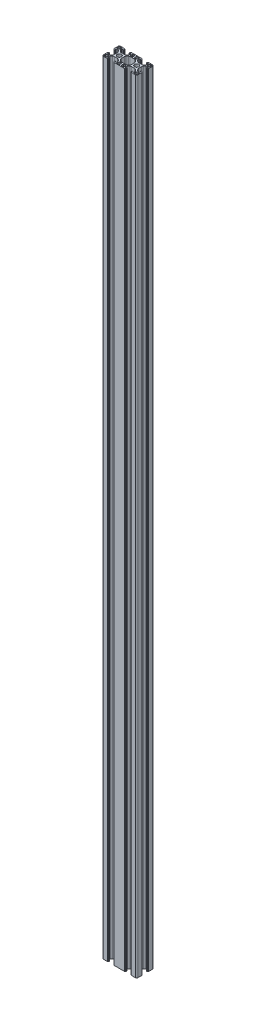
from build123d import *

# Parameters (mm, degrees)
EXTRUDE_1_DEPTH = 905


with BuildPart() as part:
    # Эскиз2 → Бобышка-Вытянуть1 (new body)
    with BuildSketch(Plane(origin=(0, 0, 0), x_dir=(1, 0, 0), z_dir=(0, 1, 0))):
        with BuildLine():
            Line((10.155065778, 4.294911016), (12.053846447, 4.294911016))
            ThreePointArc((12.053846447, 4.294911016), (12.819213312, 4.447151951), (13.468060009, 4.880697454))
            Line((13.468060009, 4.880697454), (14.76927934, 6.181916784))
            ThreePointArc((14.76927934, 6.181916784), (15.202824843, 6.830763482), (15.355065778, 7.596130347))
            Line((15.355065778, 7.596130347), (15.355065778, 8.494911016))
            ThreePointArc((15.355065778, 8.494911016), (15.208619168, 8.848464407), (14.855065778, 8.994911016))
            Line((14.855065778, 8.994911016), (14.752172559, 8.994911016))
            ThreePointArc((14.752172559, 8.994911016), (14.560830843, 8.956850782), (14.398619168, 8.848464407))
            Line((14.398619168, 8.848464407), (13.918289082, 8.368134321))
            ThreePointArc((13.918289082, 8.368134321), (13.837183245, 8.313941133), (13.741512387, 8.294911016))
            Line((13.741512387, 8.294911016), (13.455065778, 8.294911016))
            ThreePointArc((13.455065778, 8.294911016), (13.278289082, 8.368134321), (13.205065778, 8.544911016))
            Line((13.205065778, 8.544911016), (13.205065778, 9.693981836))
            ThreePointArc((13.205065778, 9.693981836), (13.248999761, 9.800047854), (13.355065778, 9.843981836))
            Line((13.355065778, 9.843981836), (13.855065778, 9.843981836))
            Line((13.855065778, 9.843981836), (13.855065778, 10.144911016))
            ThreePointArc((13.855065778, 10.144911016), (13.898999761, 10.250977033), (14.005065778, 10.294911016))
            Line((14.005065778, 10.294911016), (18.655065778, 10.294911016))
            ThreePointArc((18.655065778, 10.294911016), (19.715725949, 9.855571188), (20.155065778, 8.794911016))
            Line((20.155065778, 8.794911016), (20.155065778, 4.144911016))
            ThreePointArc((20.155065778, 4.144911016), (20.111131795, 4.038844999), (20.005065778, 3.994911016))
            Line((20.005065778, 3.994911016), (19.704136598, 3.994911016))
            Line((19.704136598, 3.994911016), (19.704136598, 3.494911016))
            ThreePointArc((19.704136598, 3.494911016), (19.660202615, 3.388844999), (19.554136598, 3.344911016))
            Line((19.554136598, 3.344911016), (18.405065778, 3.344911016))
            ThreePointArc((18.405065778, 3.344911016), (18.228289082, 3.418134321), (18.155065778, 3.594911016))
            Line((18.155065778, 3.594911016), (18.155065778, 3.881357625))
            ThreePointArc((18.155065778, 3.881357625), (18.174095895, 3.977028483), (18.228289082, 4.058134321))
            Line((18.228289082, 4.058134321), (18.708619168, 4.538464407))
            ThreePointArc((18.708619168, 4.538464407), (18.817005544, 4.700676081), (18.855065778, 4.892017797))
            Line((18.855065778, 4.892017797), (18.855065778, 4.994911016))
            ThreePointArc((18.855065778, 4.994911016), (18.708619168, 5.348464407), (18.355065778, 5.494911016))
            Line((18.355065778, 5.494911016), (17.456285109, 5.494911016))
            ThreePointArc((17.456285109, 5.494911016), (16.690918244, 5.342670081), (16.042071546, 4.909124578))
            Line((16.042071546, 4.909124578), (14.740852215, 3.607905247))
            ThreePointArc((14.740852215, 3.607905247), (14.307306713, 2.95905855), (14.155065778, 2.193691685))
            Line((14.155065778, 2.193691685), (14.155065778, 0.294911016))
            Line((14.155065778, 0.294911016), (14.155065778, -1.603869653))
            ThreePointArc((14.155065778, -1.603869653), (14.307306713, -2.369236518), (14.740852215, -3.018083216))
            Line((14.740852215, -3.018083216), (16.042071546, -4.319302546))
            ThreePointArc((16.042071546, -4.319302546), (16.690918244, -4.752848049), (17.456285109, -4.905088984))
            Line((17.456285109, -4.905088984), (18.355065778, -4.905088984))
            ThreePointArc((18.355065778, -4.905088984), (18.708619168, -4.758642375), (18.855065778, -4.405088984))
            Line((18.855065778, -4.405088984), (18.855065778, -4.302195765))
            ThreePointArc((18.855065778, -4.302195765), (18.817005544, -4.110854049), (18.708619168, -3.948642375))
            Line((18.708619168, -3.948642375), (18.228289082, -3.468312289))
            ThreePointArc((18.228289082, -3.468312289), (18.174095895, -3.387206452), (18.155065778, -3.291535593))
            Line((18.155065778, -3.291535593), (18.155065778, -3.005088984))
            ThreePointArc((18.155065778, -3.005088984), (18.228289082, -2.828312289), (18.405065778, -2.755088984))
            Line((18.405065778, -2.755088984), (19.554136598, -2.755088984))
            ThreePointArc((19.554136598, -2.755088984), (19.660202615, -2.799022967), (19.704136598, -2.905088984))
            Line((19.704136598, -2.905088984), (19.704136598, -3.405088984))
            Line((19.704136598, -3.405088984), (20.005065778, -3.405088984))
            ThreePointArc((20.005065778, -3.405088984), (20.111131795, -3.449022967), (20.155065778, -3.555088984))
            Line((20.155065778, -3.555088984), (20.155065778, -8.205088984))
            ThreePointArc((20.155065778, -8.205088984), (19.715725949, -9.265749156), (18.655065778, -9.705088984))
            Line((18.655065778, -9.705088984), (14.005065778, -9.705088984))
            ThreePointArc((14.005065778, -9.705088984), (13.898999761, -9.661155001), (13.855065778, -9.555088984))
            Line((13.855065778, -9.555088984), (13.855065778, -9.254159805))
            Line((13.855065778, -9.254159805), (13.355065778, -9.254159805))
            ThreePointArc((13.355065778, -9.254159805), (13.248999761, -9.210225822), (13.205065778, -9.104159805))
            Line((13.205065778, -9.104159805), (13.205065778, -7.955088984))
            ThreePointArc((13.205065778, -7.955088984), (13.278289082, -7.778312289), (13.455065778, -7.705088984))
            Line((13.455065778, -7.705088984), (13.741512387, -7.705088984))
            ThreePointArc((13.741512387, -7.705088984), (13.837183245, -7.724119101), (13.918289082, -7.778312289))
            Line((13.918289082, -7.778312289), (14.398619168, -8.258642375))
            ThreePointArc((14.398619168, -8.258642375), (14.560830843, -8.36702875), (14.752172559, -8.405088984))
            Line((14.752172559, -8.405088984), (14.855065778, -8.405088984))
            ThreePointArc((14.855065778, -8.405088984), (15.208619168, -8.258642375), (15.355065778, -7.905088984))
            Line((15.355065778, -7.905088984), (15.355065778, -7.006308315))
            ThreePointArc((15.355065778, -7.006308315), (15.202824843, -6.24094145), (14.76927934, -5.592094753))
            Line((14.76927934, -5.592094753), (13.468060009, -4.290875422))
            ThreePointArc((13.468060009, -4.290875422), (12.819213312, -3.857329919), (12.053846447, -3.705088984))
            Line((12.053846447, -3.705088984), (10.155065778, -3.705088984))
            Line((10.155065778, -3.705088984), (8.256285109, -3.705088984))
            ThreePointArc((8.256285109, -3.705088984), (7.490918244, -3.857329919), (6.842071546, -4.290875422))
            Line((6.842071546, -4.290875422), (5.540852215, -5.592094753))
            ThreePointArc((5.540852215, -5.592094753), (5.107306713, -6.24094145), (4.955065778, -7.006308315))
            Line((4.955065778, -7.006308315), (4.955065778, -7.905088984))
            ThreePointArc((4.955065778, -7.905088984), (5.101512387, -8.258642375), (5.455065778, -8.405088984))
            Line((5.455065778, -8.405088984), (5.557958996, -8.405088984))
            ThreePointArc((5.557958996, -8.405088984), (5.749300713, -8.36702875), (5.911512387, -8.258642375))
            Line((5.911512387, -8.258642375), (6.391842473, -7.778312289))
            ThreePointArc((6.391842473, -7.778312289), (6.47294831, -7.724119101), (6.568619168, -7.705088984))
            Line((6.568619168, -7.705088984), (6.855065778, -7.705088984))
            ThreePointArc((6.855065778, -7.705088984), (7.031842473, -7.778312289), (7.105065778, -7.955088984))
            Line((7.105065778, -7.955088984), (7.105065778, -9.104159805))
            ThreePointArc((7.105065778, -9.104159805), (7.061131795, -9.210225822), (6.955065778, -9.254159805))
            Line((6.955065778, -9.254159805), (6.455065778, -9.254159805))
            Line((6.455065778, -9.254159805), (6.455065778, -9.555088984))
            ThreePointArc((6.455065778, -9.555088984), (6.411131795, -9.661155001), (6.305065778, -9.705088984))
            Line((6.305065778, -9.705088984), (1.655065778, -9.705088984))
            Line((1.655065778, -9.705088984), (-1.344934222, -9.705088984))
            Line((-1.344934222, -9.705088984), (-5.994934222, -9.705088984))
            ThreePointArc((-5.994934222, -9.705088984), (-6.101000239, -9.661155001), (-6.144934222, -9.555088984))
            Line((-6.144934222, -9.555088984), (-6.144934222, -9.254159805))
            Line((-6.144934222, -9.254159805), (-6.644934222, -9.254159805))
            ThreePointArc((-6.644934222, -9.254159805), (-6.751000239, -9.210225822), (-6.794934222, -9.104159805))
            Line((-6.794934222, -9.104159805), (-6.794934222, -7.955088984))
            ThreePointArc((-6.794934222, -7.955088984), (-6.721710918, -7.778312289), (-6.544934222, -7.705088984))
            Line((-6.544934222, -7.705088984), (-6.258487613, -7.705088984))
            ThreePointArc((-6.258487613, -7.705088984), (-6.162816755, -7.724119101), (-6.081710918, -7.778312289))
            Line((-6.081710918, -7.778312289), (-5.601380832, -8.258642375))
            ThreePointArc((-5.601380832, -8.258642375), (-5.439169157, -8.36702875), (-5.247827441, -8.405088984))
            Line((-5.247827441, -8.405088984), (-5.144934222, -8.405088984))
            ThreePointArc((-5.144934222, -8.405088984), (-4.791380832, -8.258642375), (-4.644934222, -7.905088984))
            Line((-4.644934222, -7.905088984), (-4.644934222, -7.006308315))
            ThreePointArc((-4.644934222, -7.006308315), (-4.797175157, -6.24094145), (-5.23072066, -5.592094753))
            Line((-5.23072066, -5.592094753), (-6.531939991, -4.290875422))
            ThreePointArc((-6.531939991, -4.290875422), (-7.180786688, -3.857329919), (-7.946153553, -3.705088984))
            Line((-7.946153553, -3.705088984), (-9.844934222, -3.705088984))
            Line((-9.844934222, -3.705088984), (-11.743714891, -3.705088984))
            ThreePointArc((-11.743714891, -3.705088984), (-12.509081756, -3.857329919), (-13.157928454, -4.290875422))
            Line((-13.157928454, -4.290875422), (-14.459147785, -5.592094753))
            ThreePointArc((-14.459147785, -5.592094753), (-14.892693287, -6.24094145), (-15.044934222, -7.006308315))
            Line((-15.044934222, -7.006308315), (-15.044934222, -7.905088984))
            ThreePointArc((-15.044934222, -7.905088984), (-14.898487613, -8.258642375), (-14.544934222, -8.405088984))
            Line((-14.544934222, -8.405088984), (-14.442041004, -8.405088984))
            ThreePointArc((-14.442041004, -8.405088984), (-14.250699287, -8.36702875), (-14.088487613, -8.258642375))
            Line((-14.088487613, -8.258642375), (-13.608157527, -7.778312289))
            ThreePointArc((-13.608157527, -7.778312289), (-13.52705169, -7.724119101), (-13.431380832, -7.705088984))
            Line((-13.431380832, -7.705088984), (-13.144934222, -7.705088984))
            ThreePointArc((-13.144934222, -7.705088984), (-12.968157527, -7.778312289), (-12.894934222, -7.955088984))
            Line((-12.894934222, -7.955088984), (-12.894934222, -9.104159805))
            ThreePointArc((-12.894934222, -9.104159805), (-12.938868205, -9.210225822), (-13.044934222, -9.254159805))
            Line((-13.044934222, -9.254159805), (-13.544934222, -9.254159805))
            Line((-13.544934222, -9.254159805), (-13.544934222, -9.555088984))
            ThreePointArc((-13.544934222, -9.555088984), (-13.588868205, -9.661155001), (-13.694934222, -9.705088984))
            Line((-13.694934222, -9.705088984), (-18.344934222, -9.705088984))
            ThreePointArc((-18.344934222, -9.705088984), (-19.405594394, -9.265749156), (-19.844934222, -8.205088984))
            Line((-19.844934222, -8.205088984), (-19.844934222, -3.555088984))
            ThreePointArc((-19.844934222, -3.555088984), (-19.801000239, -3.449022967), (-19.694934222, -3.405088984))
            Line((-19.694934222, -3.405088984), (-19.394005043, -3.405088984))
            Line((-19.394005043, -3.405088984), (-19.394005043, -2.905088984))
            ThreePointArc((-19.394005043, -2.905088984), (-19.35007106, -2.799022967), (-19.244005043, -2.755088984))
            Line((-19.244005043, -2.755088984), (-18.094934222, -2.755088984))
            ThreePointArc((-18.094934222, -2.755088984), (-17.918157527, -2.828312289), (-17.844934222, -3.005088984))
            Line((-17.844934222, -3.005088984), (-17.844934222, -3.291535593))
            ThreePointArc((-17.844934222, -3.291535593), (-17.863964339, -3.387206452), (-17.918157527, -3.468312289))
            Line((-17.918157527, -3.468312289), (-18.398487613, -3.948642375))
            ThreePointArc((-18.398487613, -3.948642375), (-18.506873989, -4.110854049), (-18.544934222, -4.302195765))
            Line((-18.544934222, -4.302195765), (-18.544934222, -4.405088984))
            ThreePointArc((-18.544934222, -4.405088984), (-18.398487613, -4.758642375), (-18.044934222, -4.905088984))
            Line((-18.044934222, -4.905088984), (-17.146153553, -4.905088984))
            ThreePointArc((-17.146153553, -4.905088984), (-16.380786688, -4.752848049), (-15.731939991, -4.319302546))
            Line((-15.731939991, -4.319302546), (-14.43072066, -3.018083216))
            ThreePointArc((-14.43072066, -3.018083216), (-13.997175157, -2.369236518), (-13.844934222, -1.603869653))
            Line((-13.844934222, -1.603869653), (-13.844934222, 0.294911016))
            Line((-13.844934222, 0.294911016), (-13.844934222, 2.193691685))
            ThreePointArc((-13.844934222, 2.193691685), (-13.997175157, 2.95905855), (-14.43072066, 3.607905247))
            Line((-14.43072066, 3.607905247), (-15.731939991, 4.909124578))
            ThreePointArc((-15.731939991, 4.909124578), (-16.380786688, 5.342670081), (-17.146153553, 5.494911016))
            Line((-17.146153553, 5.494911016), (-18.044934222, 5.494911016))
            ThreePointArc((-18.044934222, 5.494911016), (-18.398487613, 5.348464407), (-18.544934222, 4.994911016))
            Line((-18.544934222, 4.994911016), (-18.544934222, 4.892017797))
            ThreePointArc((-18.544934222, 4.892017797), (-18.506873989, 4.700676081), (-18.398487613, 4.538464407))
            Line((-18.398487613, 4.538464407), (-17.918157527, 4.058134321))
            ThreePointArc((-17.918157527, 4.058134321), (-17.863964339, 3.977028483), (-17.844934222, 3.881357625))
            Line((-17.844934222, 3.881357625), (-17.844934222, 3.594911016))
            ThreePointArc((-17.844934222, 3.594911016), (-17.918157527, 3.418134321), (-18.094934222, 3.344911016))
            Line((-18.094934222, 3.344911016), (-19.244005043, 3.344911016))
            ThreePointArc((-19.244005043, 3.344911016), (-19.35007106, 3.388844999), (-19.394005043, 3.494911016))
            Line((-19.394005043, 3.494911016), (-19.394005043, 3.994911016))
            Line((-19.394005043, 3.994911016), (-19.694934222, 3.994911016))
            ThreePointArc((-19.694934222, 3.994911016), (-19.801000239, 4.038844999), (-19.844934222, 4.144911016))
            Line((-19.844934222, 4.144911016), (-19.844934222, 8.794911016))
            ThreePointArc((-19.844934222, 8.794911016), (-19.405594394, 9.855571188), (-18.344934222, 10.294911016))
            Line((-18.344934222, 10.294911016), (-13.694934222, 10.294911016))
            ThreePointArc((-13.694934222, 10.294911016), (-13.588868205, 10.250977033), (-13.544934222, 10.144911016))
            Line((-13.544934222, 10.144911016), (-13.544934222, 9.843981836))
            Line((-13.544934222, 9.843981836), (-13.044934222, 9.843981836))
            ThreePointArc((-13.044934222, 9.843981836), (-12.938868205, 9.800047854), (-12.894934222, 9.693981836))
            Line((-12.894934222, 9.693981836), (-12.894934222, 8.544911016))
            ThreePointArc((-12.894934222, 8.544911016), (-12.968157527, 8.368134321), (-13.144934222, 8.294911016))
            Line((-13.144934222, 8.294911016), (-13.431380832, 8.294911016))
            ThreePointArc((-13.431380832, 8.294911016), (-13.52705169, 8.313941133), (-13.608157527, 8.368134321))
            Line((-13.608157527, 8.368134321), (-14.088487613, 8.848464407))
            ThreePointArc((-14.088487613, 8.848464407), (-14.250699287, 8.956850782), (-14.442041004, 8.994911016))
            Line((-14.442041004, 8.994911016), (-14.544934222, 8.994911016))
            ThreePointArc((-14.544934222, 8.994911016), (-14.898487613, 8.848464407), (-15.044934222, 8.494911016))
            Line((-15.044934222, 8.494911016), (-15.044934222, 7.596130347))
            ThreePointArc((-15.044934222, 7.596130347), (-14.892693287, 6.830763482), (-14.459147785, 6.181916784))
            Line((-14.459147785, 6.181916784), (-13.157928454, 4.880697454))
            ThreePointArc((-13.157928454, 4.880697454), (-12.509081756, 4.447151951), (-11.743714891, 4.294911016))
            Line((-11.743714891, 4.294911016), (-9.844934222, 4.294911016))
            Line((-9.844934222, 4.294911016), (-7.946153553, 4.294911016))
            ThreePointArc((-7.946153553, 4.294911016), (-7.180786688, 4.447151951), (-6.531939991, 4.880697454))
            Line((-6.531939991, 4.880697454), (-5.23072066, 6.181916784))
            ThreePointArc((-5.23072066, 6.181916784), (-4.797175157, 6.830763482), (-4.644934222, 7.596130347))
            Line((-4.644934222, 7.596130347), (-4.644934222, 8.494911016))
            ThreePointArc((-4.644934222, 8.494911016), (-4.791380832, 8.848464407), (-5.144934222, 8.994911016))
            Line((-5.144934222, 8.994911016), (-5.247827441, 8.994911016))
            ThreePointArc((-5.247827441, 8.994911016), (-5.439169157, 8.956850782), (-5.601380832, 8.848464407))
            Line((-5.601380832, 8.848464407), (-6.081710918, 8.368134321))
            ThreePointArc((-6.081710918, 8.368134321), (-6.162816755, 8.313941133), (-6.258487613, 8.294911016))
            Line((-6.258487613, 8.294911016), (-6.544934222, 8.294911016))
            ThreePointArc((-6.544934222, 8.294911016), (-6.721710918, 8.368134321), (-6.794934222, 8.544911016))
            Line((-6.794934222, 8.544911016), (-6.794934222, 9.693981836))
            ThreePointArc((-6.794934222, 9.693981836), (-6.751000239, 9.800047854), (-6.644934222, 9.843981836))
            Line((-6.644934222, 9.843981836), (-6.144934222, 9.843981836))
            Line((-6.144934222, 9.843981836), (-6.144934222, 10.144911016))
            ThreePointArc((-6.144934222, 10.144911016), (-6.101000239, 10.250977033), (-5.994934222, 10.294911016))
            Line((-5.994934222, 10.294911016), (-1.344934222, 10.294911016))
            Line((-1.344934222, 10.294911016), (1.655065778, 10.294911016))
            Line((1.655065778, 10.294911016), (6.305065778, 10.294911016))
            ThreePointArc((6.305065778, 10.294911016), (6.411131795, 10.250977033), (6.455065778, 10.144911016))
            Line((6.455065778, 10.144911016), (6.455065778, 9.843981836))
            Line((6.455065778, 9.843981836), (6.955065778, 9.843981836))
            ThreePointArc((6.955065778, 9.843981836), (7.061131795, 9.800047854), (7.105065778, 9.693981836))
            Line((7.105065778, 9.693981836), (7.105065778, 8.544911016))
            ThreePointArc((7.105065778, 8.544911016), (7.031842473, 8.368134321), (6.855065778, 8.294911016))
            Line((6.855065778, 8.294911016), (6.568619168, 8.294911016))
            ThreePointArc((6.568619168, 8.294911016), (6.47294831, 8.313941133), (6.391842473, 8.368134321))
            Line((6.391842473, 8.368134321), (5.911512387, 8.848464407))
            ThreePointArc((5.911512387, 8.848464407), (5.749300713, 8.956850782), (5.557958996, 8.994911016))
            Line((5.557958996, 8.994911016), (5.455065778, 8.994911016))
            ThreePointArc((5.455065778, 8.994911016), (5.101512387, 8.848464407), (4.955065778, 8.494911016))
            Line((4.955065778, 8.494911016), (4.955065778, 7.596130347))
            ThreePointArc((4.955065778, 7.596130347), (5.107306713, 6.830763482), (5.540852215, 6.181916784))
            Line((5.540852215, 6.181916784), (6.842071546, 4.880697454))
            ThreePointArc((6.842071546, 4.880697454), (7.490918244, 4.447151951), (8.256285109, 4.294911016))
            Line((8.256285109, 4.294911016), (10.155065778, 4.294911016))
        make_face()
        with BuildLine():
            Line((17.055065778, 6.394911016), (18.455065778, 6.394911016))
            ThreePointArc((18.455065778, 6.394911016), (19.020751203, 6.629225591), (19.255065778, 7.194911016))
            Line((19.255065778, 7.194911016), (19.255065778, 8.594911016))
            ThreePointArc((19.255065778, 8.594911016), (19.020751203, 9.160596441), (18.455065778, 9.394911016))
            Line((18.455065778, 9.394911016), (17.055065778, 9.394911016))
            ThreePointArc((17.055065778, 9.394911016), (16.489380353, 9.160596441), (16.255065778, 8.594911016))
            Line((16.255065778, 8.594911016), (16.255065778, 7.194911016))
            ThreePointArc((16.255065778, 7.194911016), (16.489380353, 6.629225591), (17.055065778, 6.394911016))
        make_face(mode=Mode.SUBTRACT)
        with BuildLine():
            Line((16.255065778, -6.605088984), (16.255065778, -8.005088984))
            ThreePointArc((16.255065778, -8.005088984), (16.489380353, -8.570774409), (17.055065778, -8.805088984))
            Line((17.055065778, -8.805088984), (18.455065778, -8.805088984))
            ThreePointArc((18.455065778, -8.805088984), (19.020751203, -8.570774409), (19.255065778, -8.005088984))
            Line((19.255065778, -8.005088984), (19.255065778, -6.605088984))
            ThreePointArc((19.255065778, -6.605088984), (19.020751203, -6.039403559), (18.455065778, -5.805088984))
            Line((18.455065778, -5.805088984), (17.055065778, -5.805088984))
            ThreePointArc((17.055065778, -5.805088984), (16.489380353, -6.039403559), (16.255065778, -6.605088984))
        make_face(mode=Mode.SUBTRACT)
        with BuildLine():
            Line((3.255065778, -5.805088984), (1.855065778, -5.805088984))
            ThreePointArc((1.855065778, -5.805088984), (1.289380353, -6.039403559), (1.055065778, -6.605088984))
            Line((1.055065778, -6.605088984), (1.055065778, -8.005088984))
            ThreePointArc((1.055065778, -8.005088984), (1.289380353, -8.570774409), (1.855065778, -8.805088984))
            Line((1.855065778, -8.805088984), (3.255065778, -8.805088984))
            ThreePointArc((3.255065778, -8.805088984), (3.820751203, -8.570774409), (4.055065778, -8.005088984))
            Line((4.055065778, -8.005088984), (4.055065778, -6.605088984))
            ThreePointArc((4.055065778, -6.605088984), (3.820751203, -6.039403559), (3.255065778, -5.805088984))
        make_face(mode=Mode.SUBTRACT)
        with BuildLine():
            Line((1.955065778, -4.905088984), (2.853846447, -4.905088984))
            ThreePointArc((2.853846447, -4.905088984), (3.619213312, -4.752848049), (4.268060009, -4.319302546))
            Line((4.268060009, -4.319302546), (5.56927934, -3.018083216))
            ThreePointArc((5.56927934, -3.018083216), (6.002824843, -2.369236518), (6.155065778, -1.603869653))
            Line((6.155065778, -1.603869653), (6.155065778, 0.294911016))
            Line((6.155065778, 0.294911016), (6.155065778, 2.193691685))
            ThreePointArc((6.155065778, 2.193691685), (6.002824843, 2.95905855), (5.56927934, 3.607905247))
            Line((5.56927934, 3.607905247), (4.268060009, 4.909124578))
            ThreePointArc((4.268060009, 4.909124578), (3.619213312, 5.342670081), (2.853846447, 5.494911016))
            Line((2.853846447, 5.494911016), (1.955065778, 5.494911016))
            Line((1.955065778, 5.494911016), (-1.644934222, 5.494911016))
            Line((-1.644934222, 5.494911016), (-2.543714891, 5.494911016))
            ThreePointArc((-2.543714891, 5.494911016), (-3.309081756, 5.342670081), (-3.957928454, 4.909124578))
            Line((-3.957928454, 4.909124578), (-5.259147785, 3.607905247))
            ThreePointArc((-5.259147785, 3.607905247), (-5.692693287, 2.95905855), (-5.844934222, 2.193691685))
            Line((-5.844934222, 2.193691685), (-5.844934222, 0.294911016))
            Line((-5.844934222, 0.294911016), (-5.844934222, -1.603869653))
            ThreePointArc((-5.844934222, -1.603869653), (-5.692693287, -2.369236518), (-5.259147785, -3.018083216))
            Line((-5.259147785, -3.018083216), (-3.957928454, -4.319302546))
            ThreePointArc((-3.957928454, -4.319302546), (-3.309081756, -4.752848049), (-2.543714891, -4.905088984))
            Line((-2.543714891, -4.905088984), (-1.644934222, -4.905088984))
            Line((-1.644934222, -4.905088984), (1.955065778, -4.905088984))
        make_face(mode=Mode.SUBTRACT)
        with BuildLine():
            Line((4.055065778, 7.194911016), (4.055065778, 8.594911016))
            ThreePointArc((4.055065778, 8.594911016), (3.820751203, 9.160596441), (3.255065778, 9.394911016))
            Line((3.255065778, 9.394911016), (1.855065778, 9.394911016))
            ThreePointArc((1.855065778, 9.394911016), (1.289380353, 9.160596441), (1.055065778, 8.594911016))
            Line((1.055065778, 8.594911016), (1.055065778, 7.194911016))
            ThreePointArc((1.055065778, 7.194911016), (1.289380353, 6.629225591), (1.855065778, 6.394911016))
            Line((1.855065778, 6.394911016), (3.255065778, 6.394911016))
            ThreePointArc((3.255065778, 6.394911016), (3.820751203, 6.629225591), (4.055065778, 7.194911016))
        make_face(mode=Mode.SUBTRACT)
        with BuildLine():
            Line((-1.544934222, 9.394911016), (-2.944934222, 9.394911016))
            ThreePointArc((-2.944934222, 9.394911016), (-3.510619647, 9.160596441), (-3.744934222, 8.594911016))
            Line((-3.744934222, 8.594911016), (-3.744934222, 7.194911016))
            ThreePointArc((-3.744934222, 7.194911016), (-3.510619647, 6.629225591), (-2.944934222, 6.394911016))
            Line((-2.944934222, 6.394911016), (-1.544934222, 6.394911016))
            ThreePointArc((-1.544934222, 6.394911016), (-0.979248797, 6.629225591), (-0.744934222, 7.194911016))
            Line((-0.744934222, 7.194911016), (-0.744934222, 8.594911016))
            ThreePointArc((-0.744934222, 8.594911016), (-0.979248797, 9.160596441), (-1.544934222, 9.394911016))
        make_face(mode=Mode.SUBTRACT)
        with BuildLine():
            Line((-0.744934222, -8.005088984), (-0.744934222, -6.605088984))
            ThreePointArc((-0.744934222, -6.605088984), (-0.979248797, -6.039403559), (-1.544934222, -5.805088984))
            Line((-1.544934222, -5.805088984), (-2.944934222, -5.805088984))
            ThreePointArc((-2.944934222, -5.805088984), (-3.510619647, -6.039403559), (-3.744934222, -6.605088984))
            Line((-3.744934222, -6.605088984), (-3.744934222, -8.005088984))
            ThreePointArc((-3.744934222, -8.005088984), (-3.510619647, -8.570774409), (-2.944934222, -8.805088984))
            Line((-2.944934222, -8.805088984), (-1.544934222, -8.805088984))
            ThreePointArc((-1.544934222, -8.805088984), (-0.979248797, -8.570774409), (-0.744934222, -8.005088984))
        make_face(mode=Mode.SUBTRACT)
        with BuildLine():
            Line((-18.144934222, -8.805088984), (-16.744934222, -8.805088984))
            ThreePointArc((-16.744934222, -8.805088984), (-16.179248797, -8.570774409), (-15.944934222, -8.005088984))
            Line((-15.944934222, -8.005088984), (-15.944934222, -6.605088984))
            ThreePointArc((-15.944934222, -6.605088984), (-16.179248797, -6.039403559), (-16.744934222, -5.805088984))
            Line((-16.744934222, -5.805088984), (-18.144934222, -5.805088984))
            ThreePointArc((-18.144934222, -5.805088984), (-18.710619647, -6.039403559), (-18.944934222, -6.605088984))
            Line((-18.944934222, -6.605088984), (-18.944934222, -8.005088984))
            ThreePointArc((-18.944934222, -8.005088984), (-18.710619647, -8.570774409), (-18.144934222, -8.805088984))
        make_face(mode=Mode.SUBTRACT)
        with BuildLine():
            Line((-18.944934222, 8.594911016), (-18.944934222, 7.194911016))
            ThreePointArc((-18.944934222, 7.194911016), (-18.710619647, 6.629225591), (-18.144934222, 6.394911016))
            Line((-18.144934222, 6.394911016), (-16.744934222, 6.394911016))
            ThreePointArc((-16.744934222, 6.394911016), (-16.179248797, 6.629225591), (-15.944934222, 7.194911016))
            Line((-15.944934222, 7.194911016), (-15.944934222, 8.594911016))
            ThreePointArc((-15.944934222, 8.594911016), (-16.179248797, 9.160596441), (-16.744934222, 9.394911016))
            Line((-16.744934222, 9.394911016), (-18.144934222, 9.394911016))
            ThreePointArc((-18.144934222, 9.394911016), (-18.710619647, 9.160596441), (-18.944934222, 8.594911016))
        make_face(mode=Mode.SUBTRACT)
        with BuildLine():
            ThreePointArc((12.655065778, 0.294911016), (11.922832731, 2.062677969), (10.155065778, 2.794911016))
            ThreePointArc((10.155065778, 2.794911016), (8.387298825, 2.062677969), (7.655065778, 0.294911016))
            ThreePointArc((7.655065778, 0.294911016), (8.387298825, -1.472855937), (10.155065778, -2.205088984))
            ThreePointArc((10.155065778, -2.205088984), (11.922832731, -1.472855937), (12.655065778, 0.294911016))
        make_face(mode=Mode.SUBTRACT)
        with BuildLine():
            ThreePointArc((-9.844934222, 2.794911016), (-8.077167269, 2.062677969), (-7.344934222, 0.294911016))
            ThreePointArc((-7.344934222, 0.294911016), (-8.077167269, -1.472855937), (-9.844934222, -2.205088984))
            ThreePointArc((-9.844934222, -2.205088984), (-11.612701175, -1.472855937), (-12.344934222, 0.294911016))
            ThreePointArc((-12.344934222, 0.294911016), (-11.612701175, 2.062677969), (-9.844934222, 2.794911016))
        make_face(mode=Mode.SUBTRACT)
    extrude(amount=EXTRUDE_1_DEPTH)


solid = part.part
